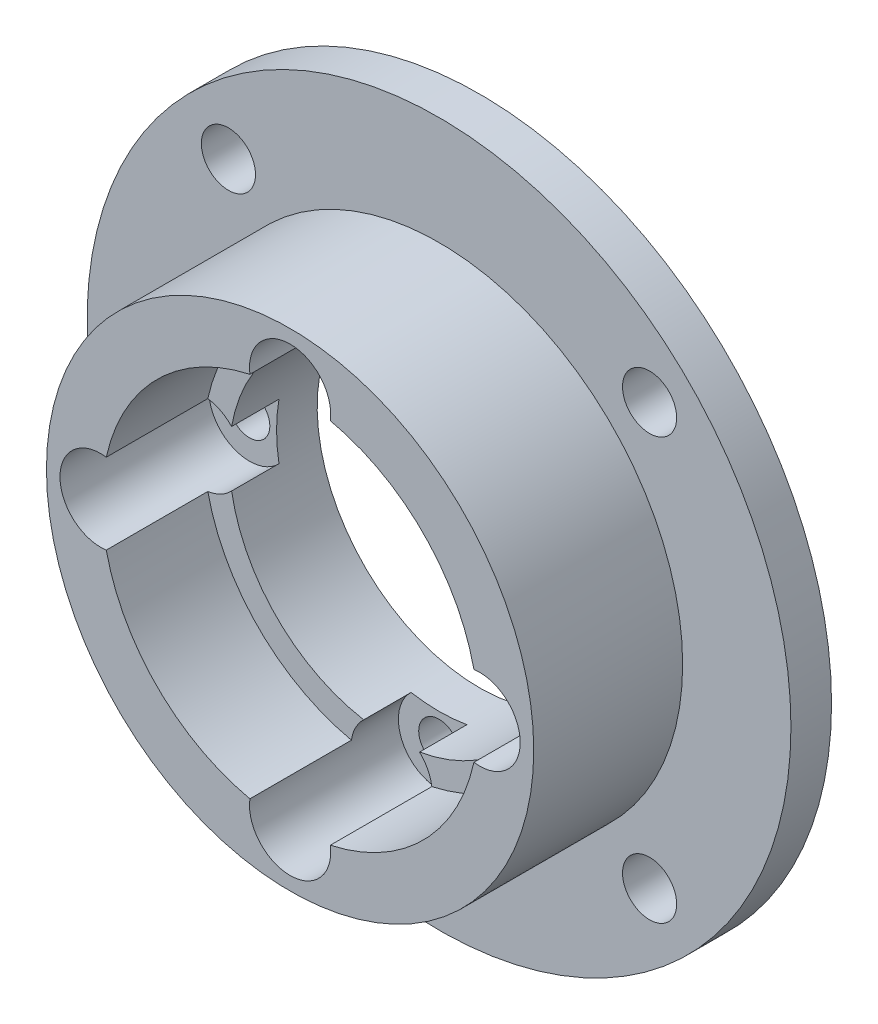
from build123d import *
from build123d.topology import SkipClean

# Parameters (mm, degrees)
SKETCH_1_R          = 26
SKETCH_1_R_2        = 12
SKETCH_1_R_3        = 2
EXTRUDE_1_DEPTH     = 3
SKETCH_2_R          = 18
SKETCH_2_R_2        = 13.9
EXTRUDE_2_DEPTH     = 11
SKETCH_3_R          = 1.5
CUT_EXTRUDE_1_DEPTH = 40.344631146
SKETCH_4_R          = 3
CUT_EXTRUDE_5_DEPTH = 11
EXTRUDE_3_DEPTH     = 3.5


with BuildPart() as part:
    # 草图1 → 凸台-拉伸1 (new body)
    with BuildSketch(Plane.XY):
        Circle(SKETCH_1_R)
        Circle(SKETCH_1_R_2, mode=Mode.SUBTRACT)
        with Locations((-15.556349186, 15.556349186)):
            Circle(SKETCH_1_R_3, mode=Mode.SUBTRACT)
        with Locations((15.556349186, 15.556349186)):
            Circle(SKETCH_1_R_3, mode=Mode.SUBTRACT)
        with Locations((15.556349186, -15.556349186)):
            Circle(SKETCH_1_R_3, mode=Mode.SUBTRACT)
        with Locations((-15.556349186, -15.556349186)):
            Circle(SKETCH_1_R_3, mode=Mode.SUBTRACT)
    extrude(amount=EXTRUDE_1_DEPTH)

    # 草图2 → 凸台-拉伸2 (add)
    with BuildSketch(Plane.XY.offset(3)):
        Circle(SKETCH_2_R)
        Circle(SKETCH_2_R_2, mode=Mode.SUBTRACT)
    extrude(amount=EXTRUDE_2_DEPTH)

    # 草图3 → 切除-拉伸1 (cut, through all)
    with BuildSketch(Plane(origin=(0, 0, 0), x_dir=(-1, 0, 0), z_dir=(0, 0, -1))):
        with Locations((0, 14)):
            Circle(SKETCH_3_R)
        with Locations((14, 0)):
            Circle(SKETCH_3_R)
        with Locations((0, -14)):
            Circle(SKETCH_3_R)
        with Locations((-14, 0)):
            Circle(SKETCH_3_R)
    extrude(amount=-CUT_EXTRUDE_1_DEPTH, mode=Mode.SUBTRACT)

    # 草图4 → 切除-拉伸5 (cut)
    with BuildSketch(Plane.XY.offset(14)):
        with Locations((0, 14)):
            Circle(SKETCH_4_R)
        with Locations((14, 0)):
            Circle(SKETCH_4_R)
        with Locations((0, -14)):
            Circle(SKETCH_4_R)
        with Locations((-14, 0)):
            Circle(SKETCH_4_R)
    extrude(amount=-CUT_EXTRUDE_5_DEPTH, mode=Mode.SUBTRACT)

    # 草图5 → 凸台-拉伸3 (add)
    with SkipClean():  # the faces are left unmerged after this step: merging them gives an invalid solid
        with BuildSketch(Plane.XY.offset(3)):
            with BuildLine():
                ThreePointArc((-13.578928571, -2.970302822), (-12.623202626, -2.665413475), (-11.821428571, -2.062480674))
                ThreePointArc((-11.821428571, -2.062480674), (-8.485281374, -8.485281374), (-2.062480674, -11.821428571))
                ThreePointArc((-2.062480674, -11.821428571), (-2.665413475, -12.623202626), (-2.970302822, -13.578928571))
                ThreePointArc((-2.970302822, -13.578928571), (-9.828784258, -9.828784258), (-13.578928571, -2.970302822))
            make_face()
            with BuildLine():
                ThreePointArc((-2.970302822, 13.578928571), (-2.665413475, 12.623202626), (-2.062480674, 11.821428571))
                ThreePointArc((-2.062480674, 11.821428571), (-8.485281374, 8.485281374), (-11.821428571, 2.062480674))
                ThreePointArc((-11.821428571, 2.062480674), (-12.623202626, 2.665413475), (-13.578928571, 2.970302822))
                ThreePointArc((-13.578928571, 2.970302822), (-9.828784258, 9.828784258), (-2.970302822, 13.578928571))
            make_face()
            with BuildLine():
                ThreePointArc((13.578928571, 2.970302822), (12.623202626, 2.665413475), (11.821428571, 2.062480674))
                ThreePointArc((11.821428571, 2.062480674), (8.485281374, 8.485281374), (2.062480674, 11.821428571))
                ThreePointArc((2.062480674, 11.821428571), (2.665413475, 12.623202626), (2.970302822, 13.578928571))
                ThreePointArc((2.970302822, 13.578928571), (9.828784258, 9.828784258), (13.578928571, 2.970302822))
            make_face()
            with BuildLine():
                ThreePointArc((2.970302822, -13.578928571), (2.665413475, -12.623202626), (2.062480674, -11.821428571))
                ThreePointArc((2.062480674, -11.821428571), (8.485281374, -8.485281374), (11.821428571, -2.062480674))
                ThreePointArc((11.821428571, -2.062480674), (12.623202626, -2.665413475), (13.578928571, -2.970302822))
                ThreePointArc((13.578928571, -2.970302822), (9.828784258, -9.828784258), (2.970302822, -13.578928571))
            make_face()
        extrude(amount=EXTRUDE_3_DEPTH)


solid = part.part
